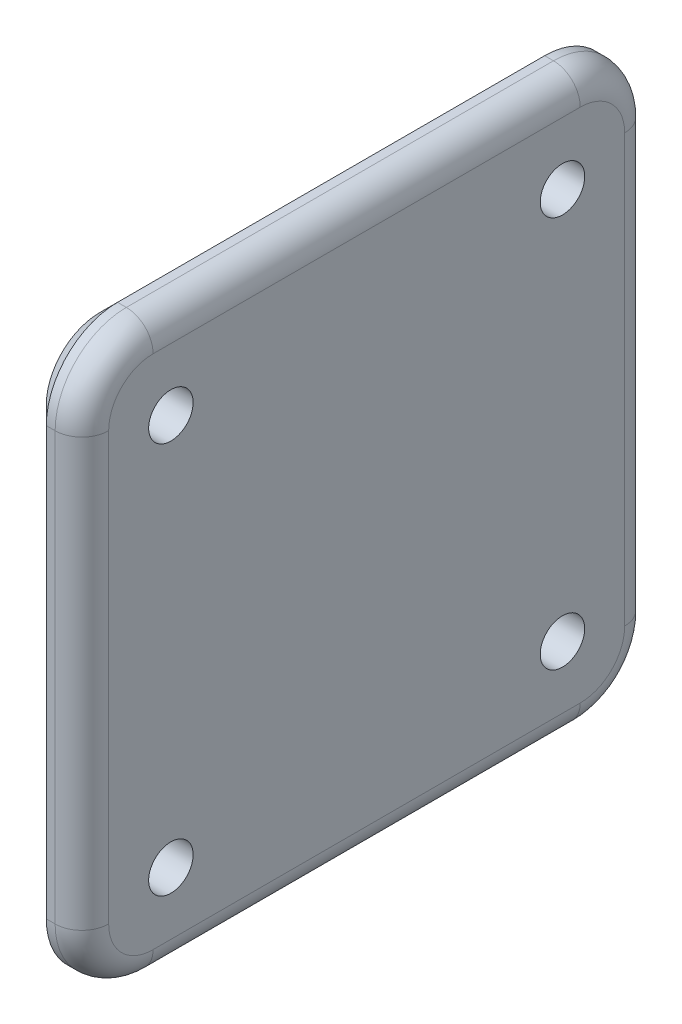
from build123d import *

# Parameters (mm, degrees)
BASE_EXTRUDE_DEPTH = 9.525
CHAMFER1_SIZE      = 3.175
FILLET1_R          = 4.7752
SKETCH2_R          = 3.96875
CUT_EXTRUDE1_DEPTH = 25.4


with BuildPart() as part:
    # Sketch1 → Base-Extrude (new body)
    with BuildSketch(Plane(origin=(0, 0, 0), x_dir=(0, 0, -1), z_dir=(1, 0, 0))):
        with BuildLine():
            Line((-127, 139.7), (-50.8, 139.7))
            ThreePointArc((-50.8, 139.7), (-41.819743879, 135.980256121), (-38.1, 127))
            Line((-38.1, 127), (-38.1, 50.8))
            ThreePointArc((-38.1, 50.8), (-41.819743879, 41.819743879), (-50.8, 38.1))
            Line((-50.8, 38.1), (-127, 38.1))
            ThreePointArc((-127, 38.1), (-135.980256121, 41.819743879), (-139.7, 50.8))
            Line((-139.7, 50.8), (-139.7, 127))
            ThreePointArc((-139.7, 127), (-135.980256121, 135.980256121), (-127, 139.7))
        make_face()
    extrude(amount=BASE_EXTRUDE_DEPTH)

    # Chamfer1
    chamfer1_edges = [part.edges().sort_by_distance(p)[0] for p in [
        (0, 38.1, 88.9),
        (0, 41.819743879, 135.980256121),
        (0, 88.9, 139.7),
        (0, 135.980256121, 135.980256121),
        (0, 139.7, 88.9),
        (0, 135.980256121, 41.819743879),
        (0, 88.9, 38.1),
        (0, 41.819743879, 41.819743879),
    ]]
    chamfer(chamfer1_edges, length=CHAMFER1_SIZE)

    # Fillet1
    fillet1_edges = [part.edges().sort_by_distance(p)[0] for p in [
        (9.525, 135.980256121, 41.819743879),
        (9.525, 139.7, 88.9),
        (9.525, 135.980256121, 135.980256121),
        (9.525, 88.9, 139.7),
        (9.525, 41.819743879, 135.980256121),
        (9.525, 38.1, 88.9),
        (9.525, 41.819743879, 41.819743879),
        (9.525, 88.9, 38.1),
    ]]
    fillet(fillet1_edges, radius=FILLET1_R)

    # Sketch2 → Cut-Extrude1 (cut)
    with BuildSketch(Plane(origin=(9.525, 0, 0), x_dir=(0, 0, -1), z_dir=(1, 0, 0))):
        with Locations((-53.975, 53.975)):
            Circle(SKETCH2_R)
        with Locations((-53.975, 123.825)):
            Circle(SKETCH2_R)
        with Locations((-123.825, 123.825)):
            Circle(SKETCH2_R)
        with Locations((-123.825, 53.975)):
            Circle(SKETCH2_R)
    extrude(amount=-CUT_EXTRUDE1_DEPTH, mode=Mode.SUBTRACT)


solid = part.part
